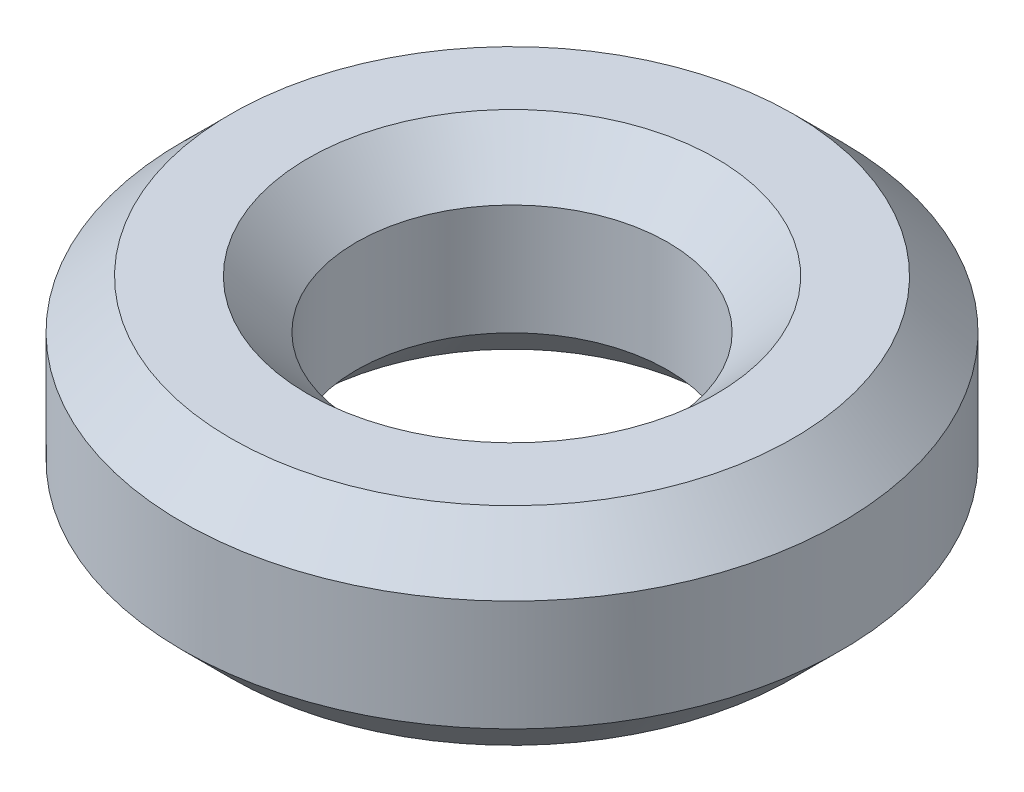
from build123d import *

# Parameters (mm, degrees)
SKETCH1_R           = 4.7625
SKETCH1_R_2         = 2.25
BOSS_EXTRUDE1_DEPTH = 3
CHAMFER1_SIZE       = 0.7


with BuildPart() as part:
    # Sketch1 → Boss-Extrude1 (new body)
    with BuildSketch(Plane(origin=(0, 0, 0), x_dir=(1, 0, 0), z_dir=(0, 1, 0))):
        with Locations(Location((0, 0, 0), (0, 0, 270))):
            Circle(SKETCH1_R)
        with Locations(Location((0, 0, 0), (0, 0, 270))):
            Circle(SKETCH1_R_2, mode=Mode.SUBTRACT)
    extrude(amount=BOSS_EXTRUDE1_DEPTH)

    # Chamfer1
    chamfer1_edges = [part.edges().sort_by_distance(p)[0] for p in [
        (0, 0, -4.7625),
        (0, 3, -4.7625),
        (0, 0, -2.25),
        (0, 3, -2.25),
    ]]
    chamfer(chamfer1_edges, length=CHAMFER1_SIZE)


solid = part.part
